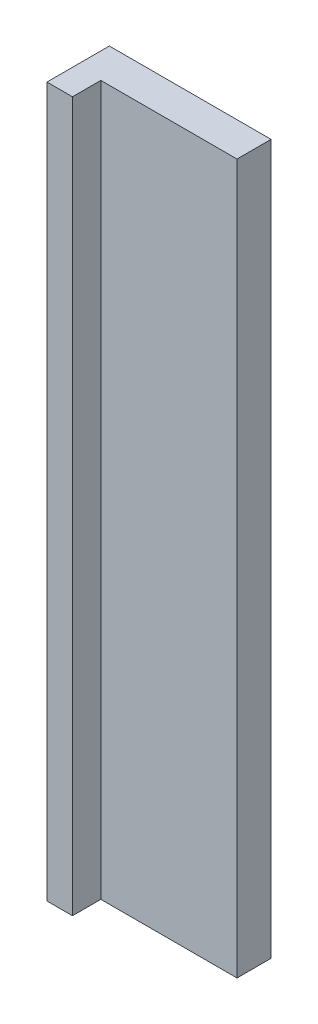
from build123d import *

# Parameters (mm, degrees)
CROQUIS1_W              = 28.5
CROQUIS1_H              = 125
SALIENTE_EXTRUIR1_DEPTH = 6
CROQUIS2_W              = 4.5
CROQUIS2_H              = 125
SALIENTE_EXTRUIR2_DEPTH = 5


with BuildPart() as part:
    # Croquis1 → Saliente-Extruir1 (new body)
    with BuildSketch(Plane.XY):
        with Locations((14.25, 62.5)):
            Rectangle(CROQUIS1_W, CROQUIS1_H)
    extrude(amount=SALIENTE_EXTRUIR1_DEPTH)

    # Croquis2 → Saliente-Extruir2 (add)
    with BuildSketch(Plane.XY.offset(6)):
        with Locations((2.25, 62.5)):
            Rectangle(CROQUIS2_W, CROQUIS2_H)
    extrude(amount=SALIENTE_EXTRUIR2_DEPTH)


solid = part.part
